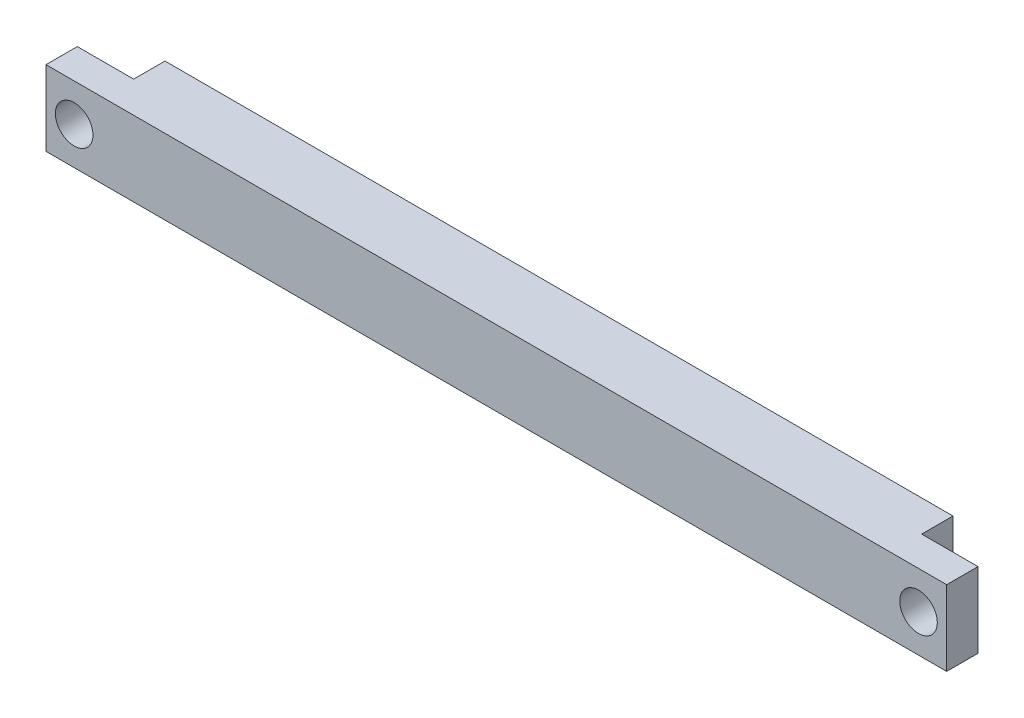
from build123d import *

# Parameters (mm, degrees)
SKETCH1_W           = 71.930298972
SKETCH1_H           = 6
BOSS_EXTRUDE1_DEPTH = 2.5
SKETCH2_R           = 1.5
CUT_EXTRUDE1_DEPTH  = 2.5
SKETCH3_W           = 62.930298972
SKETCH3_H           = 6
BOSS_EXTRUDE2_DEPTH = 2.5


with BuildPart() as part:
    # Sketch1 → Boss-Extrude1 (new body)
    with BuildSketch(Plane.XY):
        with Locations((-31.465149486, 3)):
            Rectangle(SKETCH1_W, SKETCH1_H)
    extrude(amount=BOSS_EXTRUDE1_DEPTH)

    # Sketch2 → Cut-Extrude1 (cut)
    with BuildSketch(Plane.XY.offset(2.5)):
        with Locations((2.25, 3)):
            Circle(SKETCH2_R)
        with Locations((-65.180298972, 3)):
            Circle(SKETCH2_R)
    extrude(amount=-CUT_EXTRUDE1_DEPTH, mode=Mode.SUBTRACT)

    # Sketch3 → Boss-Extrude2 (add)
    with BuildSketch(Plane(origin=(0, 0, 0), x_dir=(-1, 0, 0), z_dir=(0, 0, -1))):
        with Locations((31.465149486, 3)):
            Rectangle(SKETCH3_W, SKETCH3_H)
    extrude(amount=BOSS_EXTRUDE2_DEPTH)


solid = part.part
